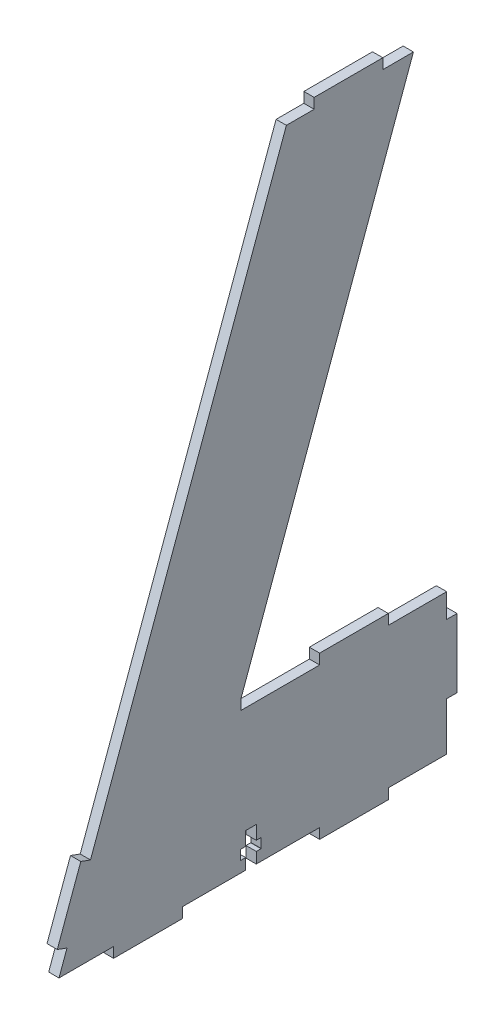
from build123d import *

# Parameters (mm, degrees)
BOSS_EXTRUDE1_DEPTH = 3
CUT_EXTRUDE1_DEPTH  = 267.131484195
SKETCH3_W           = 29.976768642
SKETCH3_H           = 52.268511193
CUT_EXTRUDE2_DEPTH  = 233.651187464
SKETCH5_W           = 11.091910703
SKETCH5_H           = 3
SKETCH5_W_2         = 10
CUT_EXTRUDE4_DEPTH  = 224.001992956
SKETCH6_W           = 20
SKETCH6_H           = 3
CUT_EXTRUDE5_DEPTH  = 224.001992956
SKETCH7_W           = 40
SKETCH7_H           = 3
CUT_EXTRUDE6_DEPTH  = 224.001992956
CUT_EXTRUDE7_REACH  = 225.002
SKETCH8_W           = 20
SKETCH8_H           = 3
CUT_EXTRUDE8_REACH  = 225.002
SKETCH9_W           = 22.898992834
SKETCH9_H           = 3
SKETCH10_W          = 3
SKETCH10_H          = 7
SKETCH10_H_2        = 13.984631039
CUT_EXTRUDE9_DEPTH  = 224.001992956
CUT_EXTRUDE10_DEPTH = 10
SKETCH13_W          = 3
SKETCH13_H          = 20
BOSS_EXTRUDE2_DEPTH = 3
CUT_EXTRUDE11_REACH = 225.002
SKETCH14_W          = 3.1
SKETCH14_H          = 10
SKETCH15_W          = 6
SKETCH15_H          = 2.8
CUT_EXTRUDE12_DEPTH = 224.001992956
SKETCH16_R          = 0.05
CUT_EXTRUDE13_DEPTH = 224.001992956
SKETCH17_R          = 0.05
CUT_EXTRUDE14_DEPTH = 10


with BuildPart() as part:
    # Sketch1 → Boss-Extrude1 (new body)
    with BuildSketch(Plane(origin=(0, 0, 0), x_dir=(0, 0, -1), z_dir=(1, 0, 0))):
        Polygon((0, 0), (120, 0), (188.404028665, 187.938524157), (68.404028665, 187.938524157), align=None)
    extrude(amount=BOSS_EXTRUDE1_DEPTH)

    # Sketch2 → Cut-Extrude1 (cut, through all)
    with BuildSketch(Plane(origin=(3, 0, 0), x_dir=(0, 0, -1), z_dir=(1, 0, 0))):
        Polygon((188.404028665, 187.938524157), (137.101007166, 46.984631039), (57.101007166, 46.984631039), (108.404028665, 187.938524157), align=None)
    extrude(amount=-CUT_EXTRUDE1_DEPTH, mode=Mode.SUBTRACT)

    # Sketch3 → Cut-Extrude2 (cut, through all)
    with BuildSketch(Plane(origin=(3, 0, 0), x_dir=(0, 0, -1), z_dir=(1, 0, 0))):
        with Locations((134.988384321, 26.134255597)):
            Rectangle(SKETCH3_W, SKETCH3_H)
    extrude(amount=-CUT_EXTRUDE2_DEPTH, mode=Mode.SUBTRACT)

    # Sketch5 → Cut-Extrude4 (cut, through all)
    with BuildSketch(Plane(origin=(3, 0, 0), x_dir=(0, 0, -1), z_dir=(1, 0, 0))):
        with Locations((72.858073314, 186.438524157)):
            Rectangle(SKETCH5_W, SKETCH5_H)
        with Locations((103.404028665, 186.438524157)):
            Rectangle(SKETCH5_W_2, SKETCH5_H)
    extrude(amount=-CUT_EXTRUDE4_DEPTH, mode=Mode.SUBTRACT)

    # Sketch6 → Cut-Extrude5 (cut, through all)
    with BuildSketch(Plane(origin=(3, 0, 0), x_dir=(0, 0, -1), z_dir=(1, 0, 0))):
        with Locations((110, 1.5)):
            Rectangle(SKETCH6_W, SKETCH6_H)
        with Locations((10, 1.5)):
            Rectangle(SKETCH6_W, SKETCH6_H)
    extrude(amount=-CUT_EXTRUDE5_DEPTH, mode=Mode.SUBTRACT)

    # Sketch7 → Cut-Extrude6 (cut, through all)
    with BuildSketch(Plane(origin=(3, 0, 0), x_dir=(0, 0, -1), z_dir=(1, 0, 0))):
        with Locations((60, 1.5)):
            Rectangle(SKETCH7_W, SKETCH7_H)
    extrude(amount=-CUT_EXTRUDE6_DEPTH, mode=Mode.SUBTRACT)

    # Sketch8 → Cut-Extrude7 (cut, up to next)
    with BuildSketch(Plane(origin=(3, 0, 0), x_dir=(0, 0, -1), z_dir=(1, 0, 0)), mode=Mode.PRIVATE) as cut_extrude7_sk1:
        with Locations((110, 45.484631039)):
            Rectangle(SKETCH8_W, SKETCH8_H)
    cut_extrude7_tool1 = extrude(cut_extrude7_sk1.sketch, amount=-CUT_EXTRUDE7_REACH, mode=Mode.PRIVATE) & part.part
    add(cut_extrude7_tool1.solids().sort_by_distance((3, 45.484631, -110))[0], mode=Mode.SUBTRACT)

    # Sketch9 → Cut-Extrude8 (cut, up to next)
    with BuildSketch(Plane(origin=(3, 0, 0), x_dir=(0, 0, -1), z_dir=(1, 0, 0)), mode=Mode.PRIVATE) as cut_extrude8_sk1:
        with Locations((68.550503583, 45.484631039)):
            Rectangle(SKETCH9_W, SKETCH9_H)
    cut_extrude8_tool1 = extrude(cut_extrude8_sk1.sketch, amount=-CUT_EXTRUDE8_REACH, mode=Mode.PRIVATE) & part.part
    add(cut_extrude8_tool1.solids().sort_by_distance((3, 45.484631, -68.550504))[0], mode=Mode.SUBTRACT)

    # Sketch10 → Cut-Extrude9 (cut, through all)
    with BuildSketch(Plane(origin=(3, 0, 0), x_dir=(0, 0, -1), z_dir=(1, 0, 0))):
        with Locations((118.5, 40.484631039)):
            Rectangle(SKETCH10_W, SKETCH10_H)
        with Locations((118.5, 9.992315519)):
            Rectangle(SKETCH10_W, SKETCH10_H_2)
    extrude(amount=-CUT_EXTRUDE9_DEPTH, mode=Mode.SUBTRACT)

    # Sketch11 → Cut-Extrude10 (cut)
    with BuildSketch(Plane(origin=(3, 0, 0), x_dir=(0, 0, -1), z_dir=(1, 0, 0))):
        Polygon((67.312117962, 184.938524157), (1.091910703, 3), (4.091910703, 3), (70.312117962, 184.938524157), align=None)
    extrude(amount=-CUT_EXTRUDE10_DEPTH, mode=Mode.SUBTRACT)

    # Sketch13 → Boss-Extrude2 (add)
    with BuildSketch(Plane(origin=(0, -0.964181415, -2.649066665), x_dir=(1, 0, 0), z_dir=(0, 0.3420201433256657, 0.9396926207859095))):
        with Locations((1.5, 21.02606043)):
            Rectangle(SKETCH13_W, SKETCH13_H)
    extrude(amount=BOSS_EXTRUDE2_DEPTH)

    # Sketch14 → Cut-Extrude11 (cut, up to next)
    with BuildSketch(Plane(origin=(3, 0, 0), x_dir=(0, 0, -1), z_dir=(1, 0, 0)), mode=Mode.PRIVATE) as cut_extrude11_sk1:
        with Locations((60, 8)):
            Rectangle(SKETCH14_W, SKETCH14_H)
    cut_extrude11_tool1 = extrude(cut_extrude11_sk1.sketch, amount=-CUT_EXTRUDE11_REACH, mode=Mode.PRIVATE) & part.part
    add(cut_extrude11_tool1.solids().sort_by_distance((3, 8, -60))[0], mode=Mode.SUBTRACT)

    # Sketch15 → Cut-Extrude12 (cut, through all)
    with BuildSketch(Plane(origin=(3, 0, 0), x_dir=(0, 0, -1), z_dir=(1, 0, 0))):
        with Locations((59.96, 7.6)):
            Rectangle(SKETCH15_W, SKETCH15_H)
    extrude(amount=-CUT_EXTRUDE12_DEPTH, mode=Mode.SUBTRACT)

    # Sketch16 → Cut-Extrude13 (cut, through all)
    with BuildSketch(Plane(origin=(3, 0, 0), x_dir=(0, 0, -1), z_dir=(1, 0, 0))):
        with Locations((56.96, 6.2)):
            Circle(SKETCH16_R)
    extrude(amount=-CUT_EXTRUDE13_DEPTH, mode=Mode.SUBTRACT)

    # Sketch17 → Cut-Extrude14 (cut)
    with BuildSketch(Plane(origin=(3, 0, 0), x_dir=(0, 0, -1), z_dir=(1, 0, 0))):
        with Locations((62.96, 6.2)):
            Circle(SKETCH17_R)
    extrude(amount=-CUT_EXTRUDE14_DEPTH, mode=Mode.SUBTRACT)


solid = part.part
